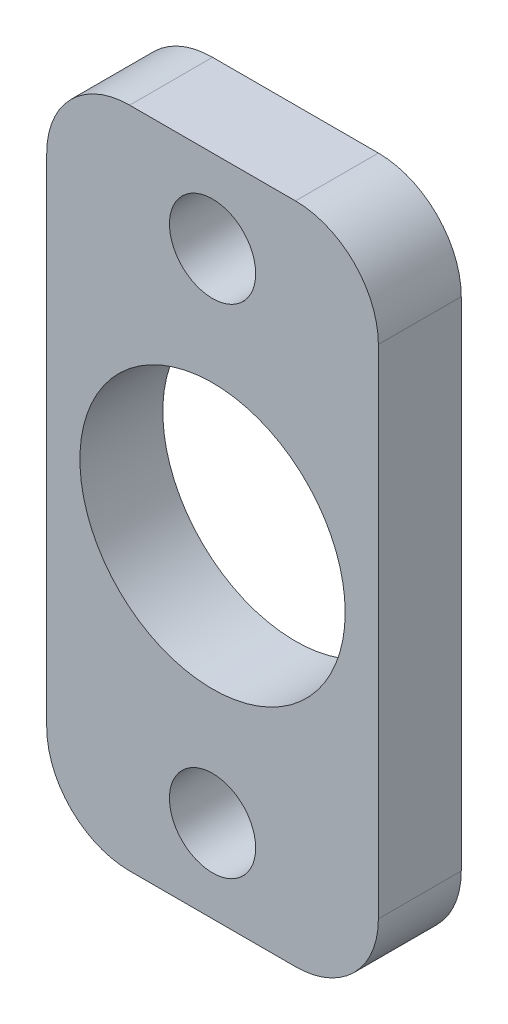
from build123d import *

# Parameters (mm, degrees)
ESBO_O1_W                = 20
ESBO_O1_H                = 40
ESBO_O1_R                = 8
RESSALTO_EXTRUS_O1_DEPTH = 2.5
ESBO_O2_R                = 2.6
CORTE_EXTRUS_O1_DEPTH    = 23.912878475
FILETE1_R                = 5


with BuildPart() as part:
    # Esboço1 → Ressalto-extrusão1 (new, symmetric)
    with BuildSketch(Plane.XY):
        Rectangle(ESBO_O1_W, ESBO_O1_H)
        Circle(ESBO_O1_R, mode=Mode.SUBTRACT)
    extrude(amount=RESSALTO_EXTRUS_O1_DEPTH, both=True)

    # Esboço2 → Corte-extrusão1 (cut, through all)
    with BuildSketch(Plane.XY.offset(2.5)):
        with Locations((0, -15)):
            Circle(ESBO_O2_R)
    corte_extrus_o1 = extrude(amount=-CORTE_EXTRUS_O1_DEPTH, mode=Mode.SUBTRACT)

    # Espelhar1: Corte-extrusão1 across plane
    add(corte_extrus_o1.mirror(Plane.ZX), mode=Mode.SUBTRACT)

    # Filete1
    filete1_edges = [part.edges().sort_by_distance(p)[0] for p in [
        (10, -20, 0),
        (-10, -20, 0),
        (-10, 20, 0),
        (10, 20, 0),
    ]]
    fillet(filete1_edges, radius=FILETE1_R)


solid = part.part
